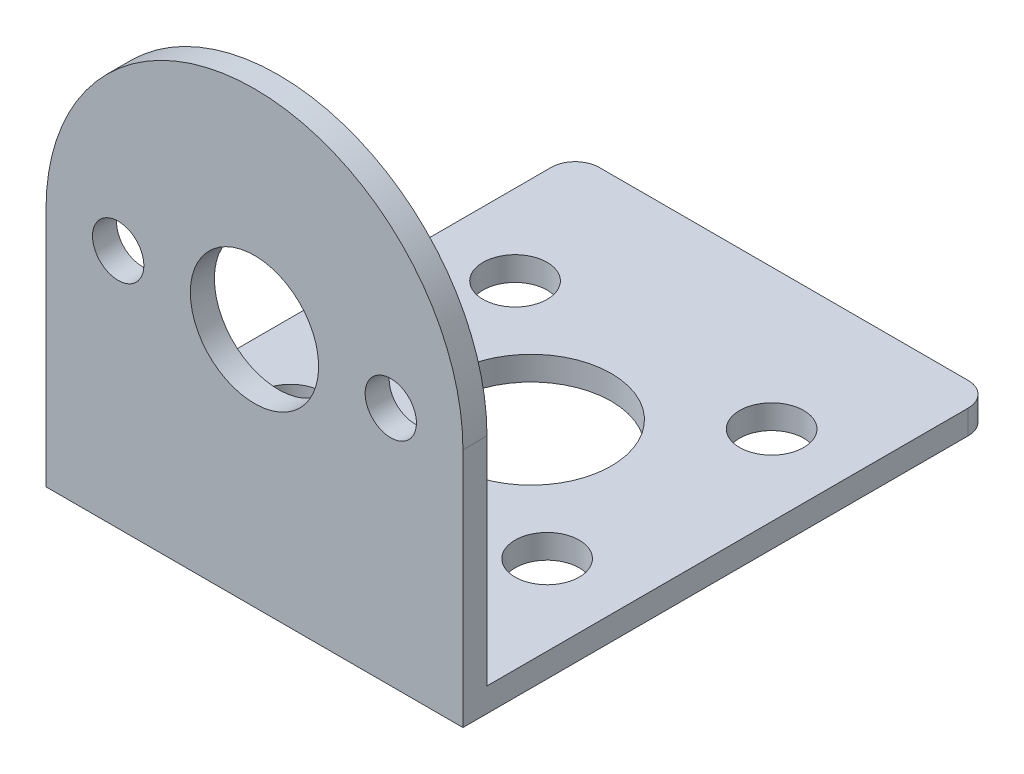
from build123d import *

# Parameters (mm, degrees)
BOSS_EXTRUDE1_DEPTH = 1.5
SKETCH2_R           = 1.6
SKETCH2_R_2         = 4
CUT_EXTRUDE1_DEPTH  = 39.23937761
SKETCH3_W           = 26
SKETCH3_H           = 1.5
BOSS_EXTRUDE4_DEPTH = 31.5
SKETCH4_R           = 5
SKETCH4_R_2         = 2
CUT_EXTRUDE2_DEPTH  = 50.520197899
FILLET1_R           = 1.5


with BuildPart() as part:
    # Sketch1 → Boss-Extrude1 (new body)
    with BuildSketch(Plane.XY):
        with BuildLine():
            Line((0, 0), (26, 0))
            Line((26, 0), (26, 15))
            ThreePointArc((26, 15), (13, 28), (0, 15))
            Line((0, 15), (0, 0))
        make_face()
    extrude(amount=BOSS_EXTRUDE1_DEPTH)

    # Sketch2 → Cut-Extrude1 (cut, through all)
    with BuildSketch(Plane(origin=(0, 0, 0), x_dir=(-1, 0, 0), z_dir=(0, 0, -1))):
        with Locations((-21.5, 15)):
            Circle(SKETCH2_R)
        with Locations((-13, 15)):
            Circle(SKETCH2_R_2)
        with Locations((-4.5, 15)):
            Circle(SKETCH2_R)
    extrude(amount=-CUT_EXTRUDE1_DEPTH, mode=Mode.SUBTRACT)

    # Sketch3 → Boss-Extrude4 (add)
    with BuildSketch(Plane(origin=(0, 0, 0), x_dir=(-1, 0, 0), z_dir=(0, 0, -1))):
        with Locations((-13, 0.75)):
            Rectangle(SKETCH3_W, SKETCH3_H)
    extrude(amount=BOSS_EXTRUDE4_DEPTH)

    # Sketch4 → Cut-Extrude2 (cut, through all)
    with BuildSketch(Plane.XZ):
        with Locations(Location((13, -15.75, 0), (0, 0, 270))):
            Circle(SKETCH4_R)
        with Locations(Location((5, -8.75, 0), (0, 0, 270))):
            Circle(SKETCH4_R_2)
        with Locations(Location((21, -8.75, 0), (0, 0, 270))):
            Circle(SKETCH4_R_2)
        with Locations(Location((21, -22.75, 0), (0, 0, 270))):
            Circle(SKETCH4_R_2)
        with Locations(Location((5, -22.75, 0), (0, 0, 270))):
            Circle(SKETCH4_R_2)
    extrude(amount=-CUT_EXTRUDE2_DEPTH, mode=Mode.SUBTRACT)

    # Fillet1
    fillet1_edges = [part.edges().sort_by_distance(p)[0] for p in [
        (26, 0.75, -31.5),
        (0, 0.75, -31.5),
    ]]
    fillet(fillet1_edges, radius=FILLET1_R)


solid = part.part
